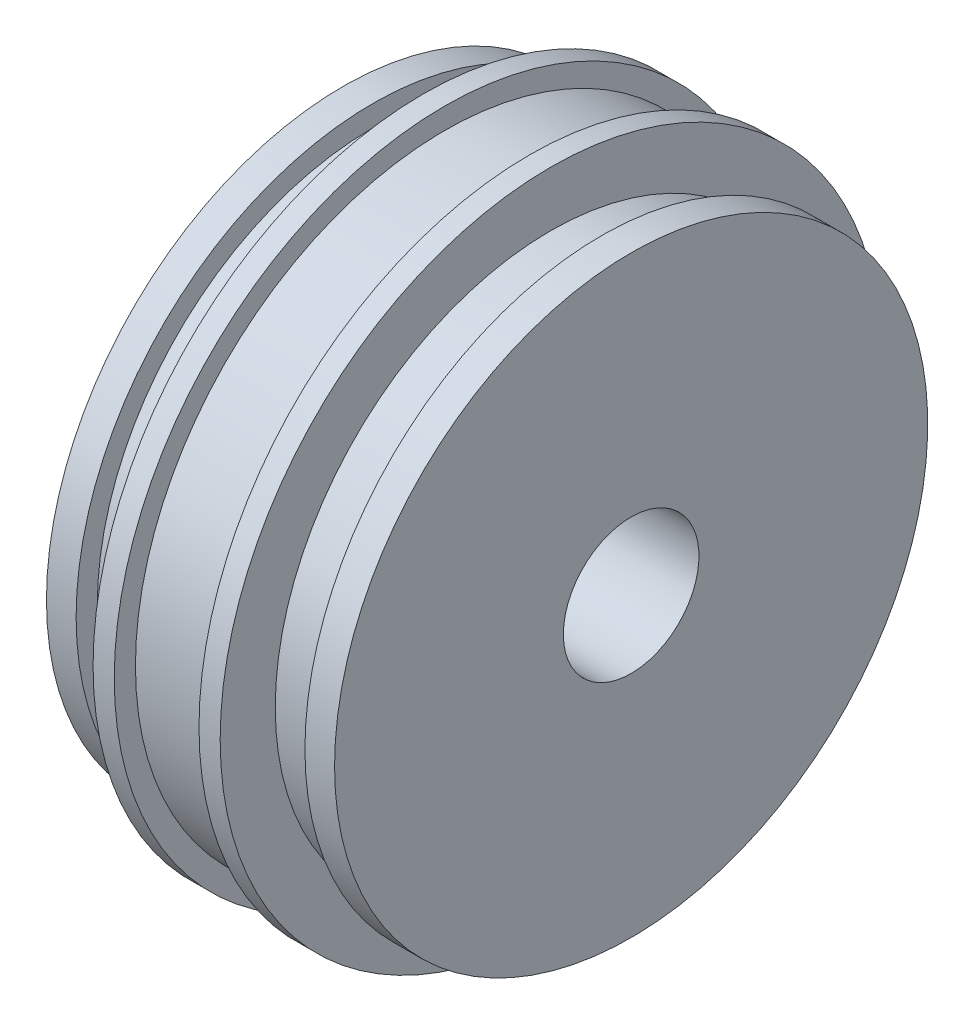
from build123d import *


with BuildPart() as part:
    # Croquis1 → Revolución1 (revolve)
    with BuildSketch(Plane.XY, mode=Mode.PRIVATE) as revoluci_n1_sk:
        Polygon((7.346100741, 8.5), (7.346100741, 35.5), (10.846100741, 35.5), (10.846100741, 33), (16.846100741, 33), (16.846100741, 39.5), (19.346100741, 39.5), (19.346100741, 37), (29.346100741, 37), (29.346100741, 39.5), (31.846100741, 39.5), (31.846100741, 33), (37.846100741, 33), (37.846100741, 35.5), (41.346100741, 35.5), (41.346100741, 8.5), align=None)
    revolve(revoluci_n1_sk.sketch.rotate(Axis((-1, 0.5, 0), (1, 0, 0)), 90), axis=Axis((-1, 0.5, 0), (1, 0, 0)))


solid = part.part
